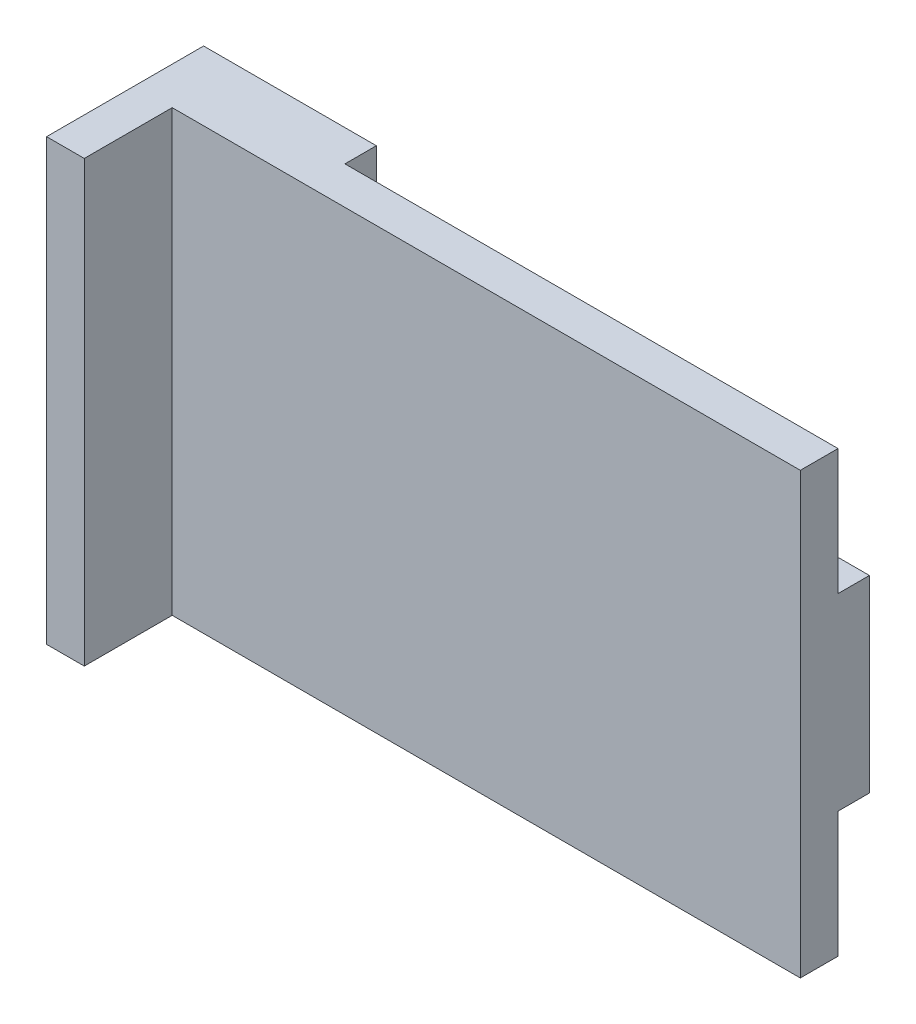
from build123d import *

# Parameters (mm, degrees)
SKETCH_1_W      = 20
SKETCH_1_H      = 70
EXTRUDE_1_DEPTH = 6
SKETCH_2_W      = 6
SKETCH_2_H      = 70
EXTRUDE_2_DEPTH = 100
EXTRUDE_3_DEPTH = 5


with BuildPart() as part:
    # 草图1 → 凸台-拉伸1 (new body)
    with BuildSketch(Plane(origin=(0, 0, 0), x_dir=(0, 0, -1), z_dir=(1, 0, 0))):
        with Locations((-10, 0)):
            Rectangle(SKETCH_1_W, SKETCH_1_H)
    extrude(amount=EXTRUDE_1_DEPTH)

    # 草图2 → 凸台-拉伸2 (add)
    with BuildSketch(Plane(origin=(6, 0, 0), x_dir=(0, 0, -1), z_dir=(1, 0, 0))):
        with Locations((-3, 0)):
            Rectangle(SKETCH_2_W, SKETCH_2_H)
    extrude(amount=EXTRUDE_2_DEPTH)

    # 草图3 → 凸台-拉伸3 (add)
    with BuildSketch(Plane(origin=(0, 0, 0), x_dir=(-1, 0, 0), z_dir=(0, 0, -1))):
        Polygon((0, -35), (-27.5, -35), (-27.5, -15), (-106, -15), (-106, 15), (-27.5, 15), (-27.5, 35), (0, 35), align=None)
    extrude(amount=EXTRUDE_3_DEPTH)


solid = part.part
